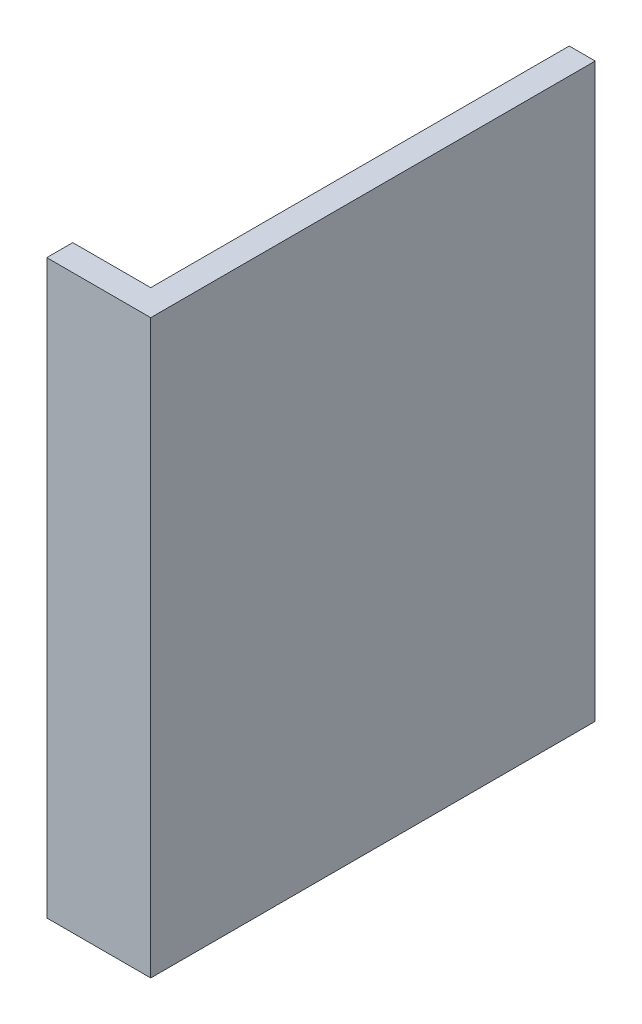
from build123d import *

# Parameters (mm, degrees)
BOSS_EXTRUDE1_DEPTH = 11


with BuildPart() as part:
    # Sketch1 → Boss-Extrude1 (new body)
    with BuildSketch(Plane(origin=(0, 0, 0), x_dir=(1, 0, 0), z_dir=(0, 1, 0))):
        Polygon((-2, 0), (0, 0), (0, 8.55), (-0.5, 8.55), (-0.5, 0.5), (-2, 0.5), align=None)
    extrude(amount=BOSS_EXTRUDE1_DEPTH)


solid = part.part
